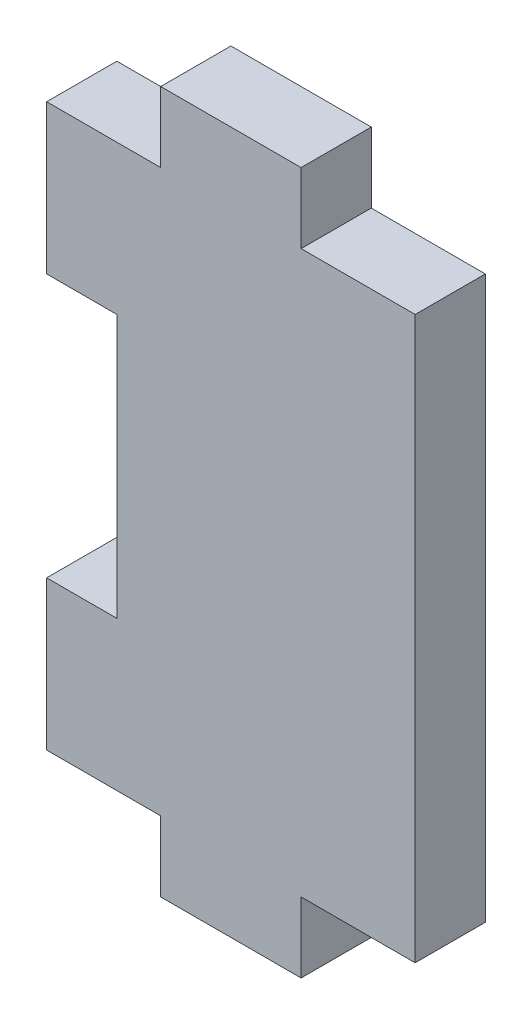
from build123d import *

# Parameters (mm, degrees)
SKETCH_1_W          = 21
SKETCH_1_H          = 40
EXTRUDE_1_DEPTH     = 4
SKETCH_2_W          = 6.5
SKETCH_2_H          = 4
SKETCH_2_W_2        = 4
SKETCH_2_H_2        = 15
CUT_EXTRUDE_1_DEPTH = 4


with BuildPart() as part:
    # Эскиз1 → Бобышка-Вытянуть1 (new body)
    with BuildSketch(Plane.XY):
        with Locations((10.5, 20)):
            Rectangle(SKETCH_1_W, SKETCH_1_H)
    extrude(amount=EXTRUDE_1_DEPTH)

    # Эскиз2 → Вырез-Вытянуть1 (cut)
    with BuildSketch(Plane.XY.offset(4)):
        with Locations((17.75, 38)):
            Rectangle(SKETCH_2_W, SKETCH_2_H)
        with Locations((3.25, 38)):
            Rectangle(SKETCH_2_W, SKETCH_2_H)
        with Locations((17.75, 2)):
            Rectangle(SKETCH_2_W, SKETCH_2_H)
        with Locations((3.25, 2)):
            Rectangle(SKETCH_2_W, SKETCH_2_H)
        with Locations((2, 20)):
            Rectangle(SKETCH_2_W_2, SKETCH_2_H_2)
    extrude(amount=-CUT_EXTRUDE_1_DEPTH, mode=Mode.SUBTRACT)


solid = part.part
